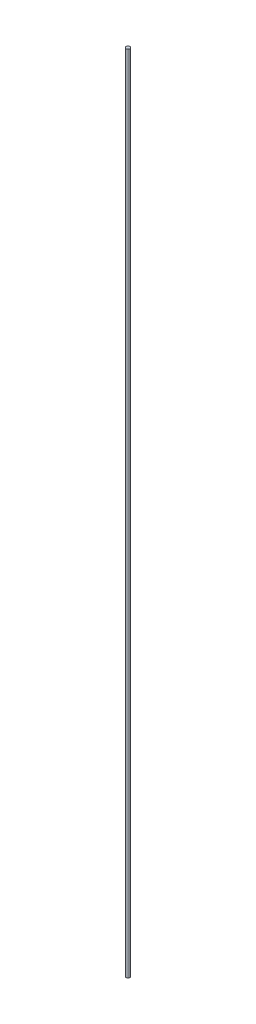
from build123d import *

# Parameters (mm, degrees)
SKETCH1_R           = 2.38125
BOSS_EXTRUDE1_DEPTH = 1000


with BuildPart() as part:
    # Sketch1 → Boss-Extrude1 (new body)
    with BuildSketch(Plane(origin=(0, 0, 0), x_dir=(1, 0, 0), z_dir=(0, 1, 0))):
        with Locations(Location((0, 0, 0), (0, 0, 270))):
            Circle(SKETCH1_R)
    extrude(amount=BOSS_EXTRUDE1_DEPTH)


solid = part.part
